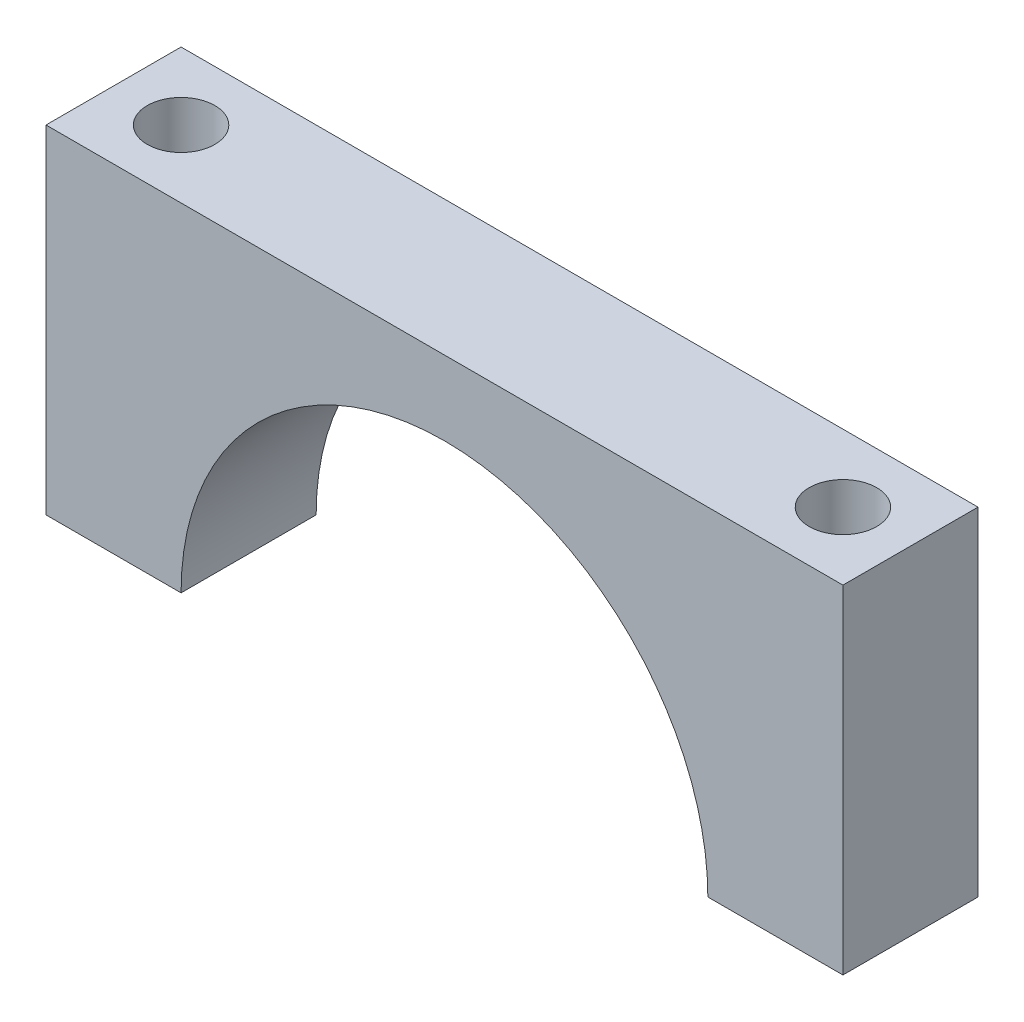
from build123d import *

# Parameters (mm, degrees)
BOSS_EXTRUDE1_DEPTH = 10
SKETCH2_R           = 2.5
CUT_EXTRUDE2_DEPTH  = 40.940580867


with BuildPart() as part:
    # Sketch1 → Boss-Extrude1 (new body)
    with BuildSketch(Plane.XY):
        with BuildLine():
            Line((-19.5, 0), (-29.5, 0))
            Line((-29.5, 0), (-29.5, 25))
            Line((-29.5, 25), (29.5, 25))
            Line((29.5, 25), (29.5, 0))
            Line((29.5, 0), (19.5, 0))
            ThreePointArc((19.5, 0), (0, 19.5), (-19.5, 0))
        make_face()
    extrude(amount=BOSS_EXTRUDE1_DEPTH)

    # Sketch2 → Cut-Extrude2 (cut, through all)
    with BuildSketch(Plane(origin=(0, 0, 0), x_dir=(1, 0, 0), z_dir=(0, 1, 0))):
        with Locations(Location((-24.5, -5, 0), (0, 0, 270))):
            Circle(SKETCH2_R)
        with Locations(Location((24.5, -5, 0), (0, 0, 270))):
            Circle(SKETCH2_R)
    extrude(amount=CUT_EXTRUDE2_DEPTH, mode=Mode.SUBTRACT)


solid = part.part
